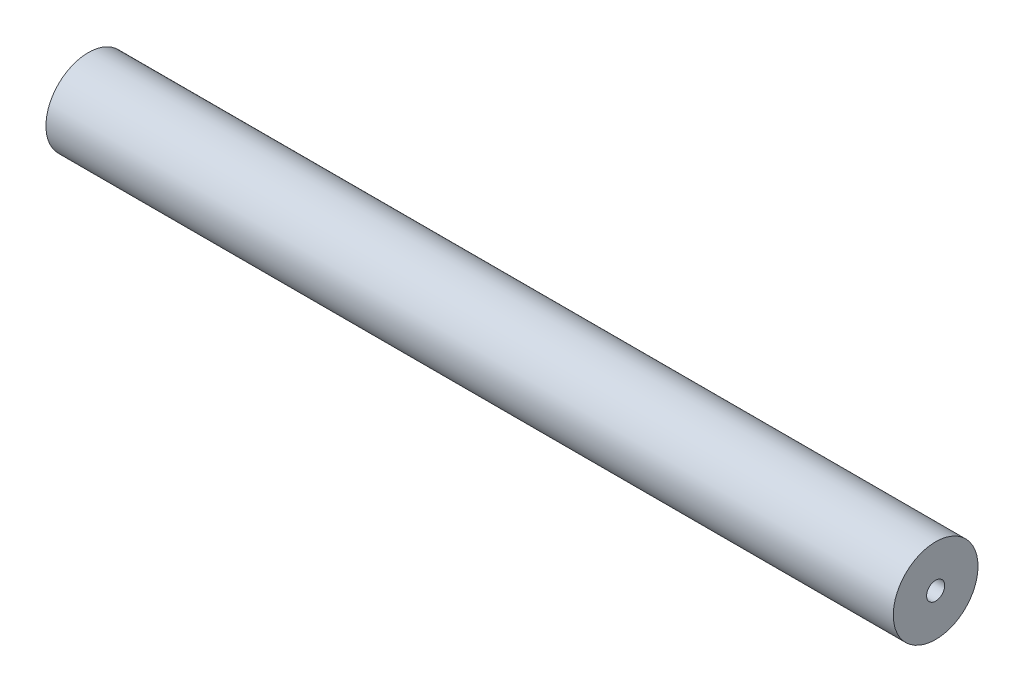
from build123d import *

# Parameters (mm, degrees)
SKETCH_1_R      = 7.5
SKETCH_1_R_2    = 1.6
EXTRUDE_1_DEPTH = 150


with BuildPart() as part:
    # 草图1 → 凸台-拉伸1 (new body)
    with BuildSketch(Plane(origin=(0, 0, 0), x_dir=(0, 0, -1), z_dir=(1, 0, 0))):
        Circle(SKETCH_1_R)
        Circle(SKETCH_1_R_2, mode=Mode.SUBTRACT)
    extrude(amount=EXTRUDE_1_DEPTH)


solid = part.part
